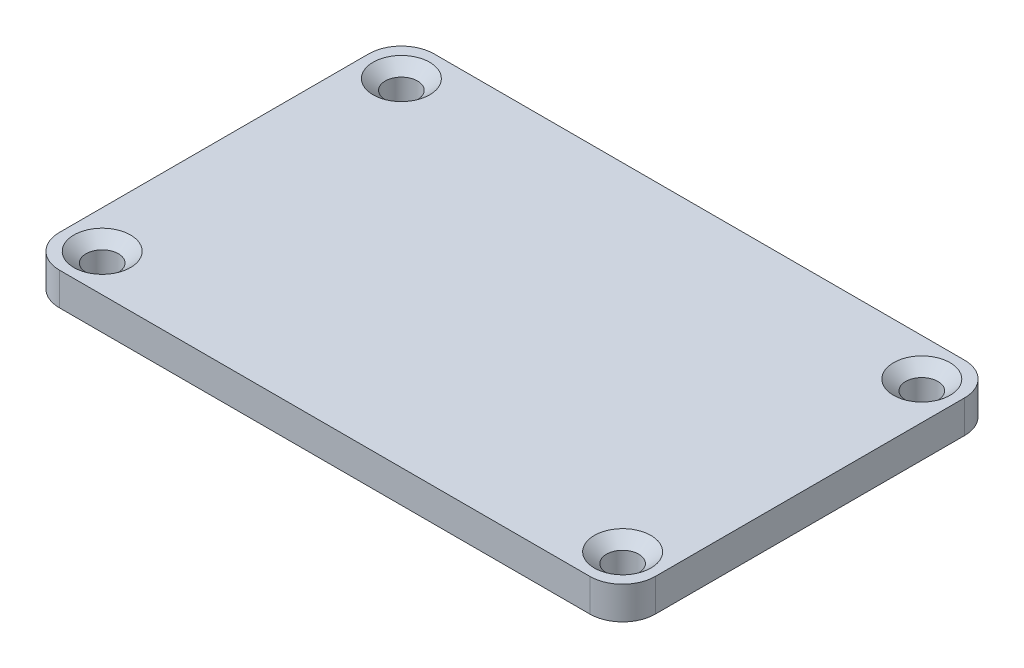
from build123d import *

# Parameters (mm, degrees)
SKETCH1_W                                         = 60.198
SKETCH1_H                                         = 37.846
BOSS_EXTRUDE1_DEPTH                               = 3.302
FILLET1_R                                         = 3.302
CSK_FOR_4_FLAT_HEAD_MACHINE_SCREW_100_D           = 3.2639
CSK_FOR_4_FLAT_HEAD_MACHINE_SCREW_100_CSINK_D     = 5.715
CSK_FOR_4_FLAT_HEAD_MACHINE_SCREW_100_CSINK_ANGLE = 100


with BuildPart() as part:
    # Sketch1 → Boss-Extrude1 (new body)
    with BuildSketch(Plane(origin=(0, 0, 0), x_dir=(1, 0, 0), z_dir=(0, 1, 0))):
        Rectangle(SKETCH1_W, SKETCH1_H)
    extrude(amount=BOSS_EXTRUDE1_DEPTH)

    # Fillet1
    fillet1_edges = [part.edges().sort_by_distance(p)[0] for p in [
        (30.099, 1.651, 18.923),
        (-30.099, 1.651, 18.923),
        (-30.099, 1.651, -18.923),
        (30.099, 1.651, -18.923),
    ]]
    fillet(fillet1_edges, radius=FILLET1_R)

    # CSK for #4 Flat Head Machine Screw (100)1 (through all)
    with Locations(Plane(origin=(0, 3.302, 0), x_dir=(1, 0, 0), z_dir=(0, 1, 0))):
        with Locations((-26.289, 15.113), (-26.289, -15.113), (26.289, -15.113), (26.289, 15.113)):
            CounterSinkHole(CSK_FOR_4_FLAT_HEAD_MACHINE_SCREW_100_D / 2, CSK_FOR_4_FLAT_HEAD_MACHINE_SCREW_100_CSINK_D / 2, counter_sink_angle=CSK_FOR_4_FLAT_HEAD_MACHINE_SCREW_100_CSINK_ANGLE)


solid = part.part
